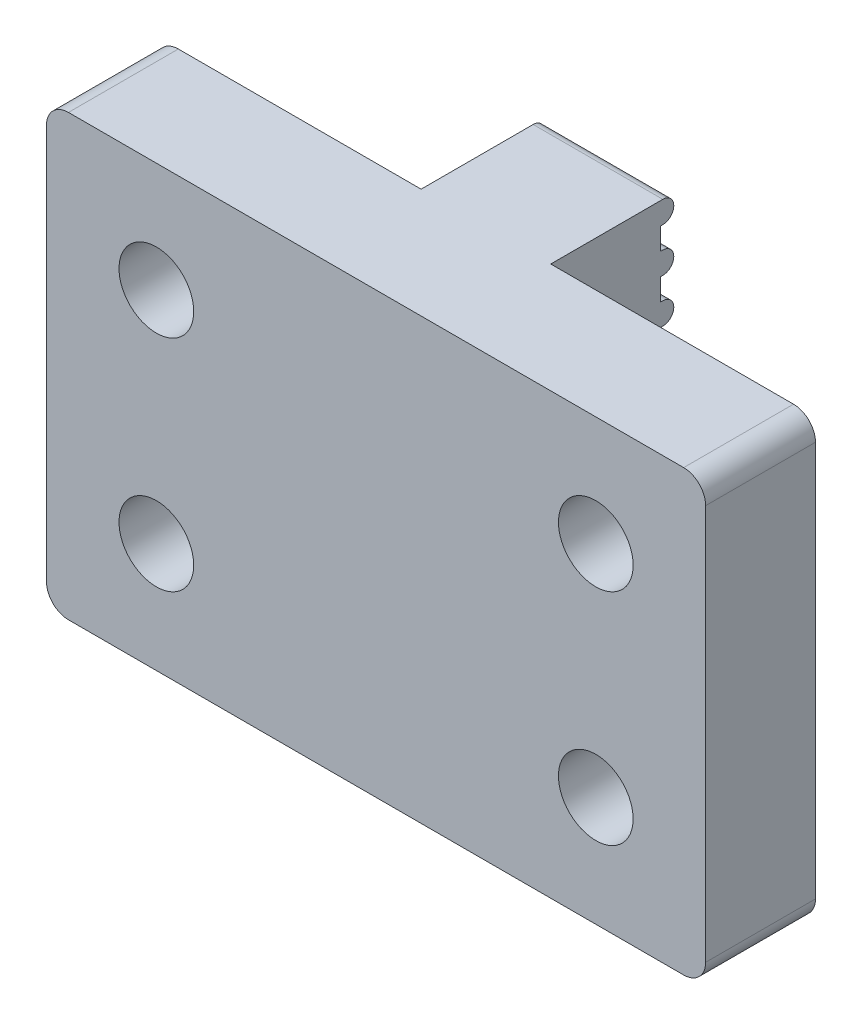
from build123d import *

# Parameters (mm, degrees)
OUTER_BLOCK_SKETCH_W               = 30
OUTER_BLOCK_SKETCH_H               = 20
MAIN_BLOCK_DEPTH                   = 5
BELT_TRAP_BLOCK_SKETCH_W           = 5.9
BELT_TRAP_BLOCK_SKETCH_H           = 20
BELT_TRAP_BLOCK_DEPTH              = 5
M3_CLEARANCE_HOLE1_D               = 3.4
BELT_TRAPPING_RIDGE_MASTER_DEPTH   = 5.9
BELT_TRAPPING_RIDGES_PATTERN_COUNT = 10
BELT_TRAPPING_RIDGES_PATTERN_PITCH = 2
PRINT_HELPER_FILLETS_R             = 1


with BuildPart() as part:
    # Outer Block Sketch → Main Block (new body)
    with BuildSketch(Plane.XY):
        Rectangle(OUTER_BLOCK_SKETCH_W, OUTER_BLOCK_SKETCH_H)
    extrude(amount=MAIN_BLOCK_DEPTH)

    # Belt Trap Block Sketch → Belt Trap Block (add)
    with BuildSketch(Plane.XY):
        Rectangle(BELT_TRAP_BLOCK_SKETCH_W, BELT_TRAP_BLOCK_SKETCH_H)
    extrude(amount=-BELT_TRAP_BLOCK_DEPTH)

    # M3 Clearance Hole1 (through all)
    with Locations(Plane.XY.offset(5)):
        with Locations((-10, 5), (10, 5), (-10, -5), (10, -5)):
            Hole(M3_CLEARANCE_HOLE1_D / 2)

    # Belt Trapping Ridges Sketch → Belt Trapping Ridge (Master) (add)
    with BuildSketch(Plane(origin=(2.95, 0, 0), x_dir=(0, 0, -1), z_dir=(1, 0, 0))):
        with BuildLine():
            Line((5, 10), (5.1, 10))
            ThreePointArc((5.1, 10), (5.6, 9.5), (5.1, 9))
            Line((5.1, 9), (5, 9))
            Line((5, 9), (5, 10))
        make_face()
    belt_trapping_ridge_master = extrude(amount=-BELT_TRAPPING_RIDGE_MASTER_DEPTH)

    # Belt Trapping Ridges Pattern: Belt Trapping Ridge (Master) ×10
    with Locations(*[(0, -i * BELT_TRAPPING_RIDGES_PATTERN_PITCH, 0) for i in range(1, BELT_TRAPPING_RIDGES_PATTERN_COUNT)]):
        add(belt_trapping_ridge_master)

    # Print Helper Fillets
    print_helper_fillets_edges = [part.edges().sort_by_distance(p)[0] for p in [
        (15, -10, 2.5),
        (15, 10, 2.5),
        (-15, -10, 2.5),
        (-15, 10, 2.5),
        (-2.95, -10, -2.5),
        (2.95, -10, -2.5),
    ]]
    fillet(print_helper_fillets_edges, radius=PRINT_HELPER_FILLETS_R)


solid = part.part
